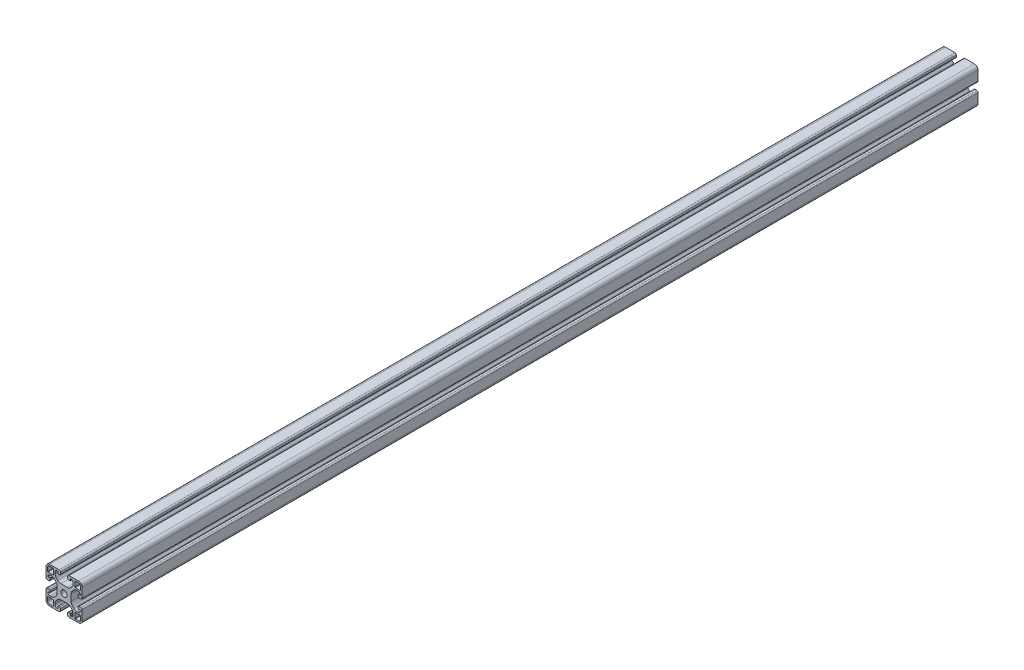
from build123d import *

# Parameters (mm, degrees)
ESQUISSE1_R        = 3.4
BOSS_EXTRU_1_DEPTH = 990


with BuildPart() as part:
    # Esquisse1 → Boss.-Extru.1 (new body)
    with BuildSketch(Plane(origin=(0, 0, -30), x_dir=(-1, 0, 0), z_dir=(0, 0, -1))):
        with BuildLine():
            Line((-4.5, 15), (-4.5, 13.5))
            ThreePointArc((-4.5, 13.5), (-4.353553391, 13.146446609), (-4, 13))
            Line((-4, 13), (-2.5, 13))
            ThreePointArc((-2.5, 13), (-2.146446609, 12.853553391), (-2, 12.5))
            ThreePointArc((-2, 12.5), (-2.732233047, 10.732233047), (-4.5, 10))
            Line((-4.5, 10), (-5.807611845, 10))
            ThreePointArc((-5.807611845, 10), (-7.721029006, 10.380602337), (-9.343145751, 11.464466094))
            Line((-9.343145751, 11.464466094), (-10.785533906, 12.906854249))
            ThreePointArc((-10.785533906, 12.906854249), (-11.869397663, 14.528970994), (-12.25, 16.442388155))
            Line((-12.25, 16.442388155), (-12.25, 23.557611845))
            ThreePointArc((-12.25, 23.557611845), (-11.869397663, 25.471029006), (-10.785533906, 27.093145751))
            Line((-10.785533906, 27.093145751), (-9.343145751, 28.535533906))
            ThreePointArc((-9.343145751, 28.535533906), (-7.721029006, 29.619397663), (-5.807611845, 30))
            Line((-5.807611845, 30), (-4.5, 30))
            ThreePointArc((-4.5, 30), (-2.732233047, 29.267766953), (-2, 27.5))
            ThreePointArc((-2, 27.5), (-2.146446609, 27.146446609), (-2.5, 27))
            Line((-2.5, 27), (-4, 27))
            ThreePointArc((-4, 27), (-4.353553391, 26.853553391), (-4.5, 26.5))
            Line((-4.5, 26.5), (-4.5, 25))
            ThreePointArc((-4.5, 25), (-4.207106781, 24.292893219), (-3.5, 24))
            Line((-3.5, 24), (-1.5, 24))
            ThreePointArc((-1.5, 24), (-0.439339828, 24.439339828), (0, 25.5))
            Line((0, 25.5), (0, 36))
            ThreePointArc((0, 36), (-1.171572875, 38.828427125), (-4, 40))
            Line((-4, 40), (-14.5, 40))
            ThreePointArc((-14.5, 40), (-15.560660172, 39.560660172), (-16, 38.5))
            Line((-16, 38.5), (-16, 36.5))
            ThreePointArc((-16, 36.5), (-15.707106781, 35.792893219), (-15, 35.5))
            Line((-15, 35.5), (-13.5, 35.5))
            ThreePointArc((-13.5, 35.5), (-13.146446609, 35.646446609), (-13, 36))
            Line((-13, 36), (-13, 37.5))
            ThreePointArc((-13, 37.5), (-12.853553391, 37.853553391), (-12.5, 38))
            ThreePointArc((-12.5, 38), (-10.732233047, 37.267766953), (-10, 35.5))
            Line((-10, 35.5), (-10, 34.192388155))
            ThreePointArc((-10, 34.192388155), (-10.380602337, 32.278970994), (-11.464466094, 30.656854249))
            Line((-11.464466094, 30.656854249), (-12.906854249, 29.214466094))
            ThreePointArc((-12.906854249, 29.214466094), (-14.528970994, 28.130602337), (-16.442388155, 27.75))
            Line((-16.442388155, 27.75), (-23.557611845, 27.75))
            ThreePointArc((-23.557611845, 27.75), (-25.471029006, 28.130602337), (-27.093145751, 29.214466094))
            Line((-27.093145751, 29.214466094), (-28.535533906, 30.656854249))
            ThreePointArc((-28.535533906, 30.656854249), (-29.619397663, 32.278970994), (-30, 34.192388155))
            Line((-30, 34.192388155), (-30, 35.5))
            ThreePointArc((-30, 35.5), (-29.267766953, 37.267766953), (-27.5, 38))
            ThreePointArc((-27.5, 38), (-27.146446609, 37.853553391), (-27, 37.5))
            Line((-27, 37.5), (-27, 36))
            ThreePointArc((-27, 36), (-26.853553391, 35.646446609), (-26.5, 35.5))
            Line((-26.5, 35.5), (-25, 35.5))
            ThreePointArc((-25, 35.5), (-24.292893219, 35.792893219), (-24, 36.5))
            Line((-24, 36.5), (-24, 38.5))
            ThreePointArc((-24, 38.5), (-24.439339828, 39.560660172), (-25.5, 40))
            Line((-25.5, 40), (-36, 40))
            ThreePointArc((-36, 40), (-38.828427125, 38.828427125), (-40, 36))
            Line((-40, 36), (-40, 25.5))
            ThreePointArc((-40, 25.5), (-39.560660172, 24.439339828), (-38.5, 24))
            Line((-38.5, 24), (-36.5, 24))
            ThreePointArc((-36.5, 24), (-35.792893219, 24.292893219), (-35.5, 25))
            Line((-35.5, 25), (-35.5, 26.5))
            ThreePointArc((-35.5, 26.5), (-35.646446609, 26.853553391), (-36, 27))
            Line((-36, 27), (-37.5, 27))
            ThreePointArc((-37.5, 27), (-37.853553391, 27.146446609), (-38, 27.5))
            ThreePointArc((-38, 27.5), (-37.267766953, 29.267766953), (-35.5, 30))
            Line((-35.5, 30), (-34.192388155, 30))
            ThreePointArc((-34.192388155, 30), (-32.278970994, 29.619397663), (-30.656854249, 28.535533906))
            Line((-30.656854249, 28.535533906), (-29.214466094, 27.093145751))
            ThreePointArc((-29.214466094, 27.093145751), (-28.130602337, 25.471029006), (-27.75, 23.557611845))
            Line((-27.75, 23.557611845), (-27.75, 16.442388155))
            ThreePointArc((-27.75, 16.442388155), (-28.130602337, 14.528970994), (-29.214466094, 12.906854249))
            Line((-29.214466094, 12.906854249), (-30.656854249, 11.464466094))
            ThreePointArc((-30.656854249, 11.464466094), (-32.278970994, 10.380602337), (-34.192388155, 10))
            Line((-34.192388155, 10), (-35.5, 10))
            ThreePointArc((-35.5, 10), (-37.267766953, 10.732233047), (-38, 12.5))
            ThreePointArc((-38, 12.5), (-37.853553391, 12.853553391), (-37.5, 13))
            Line((-37.5, 13), (-36, 13))
            ThreePointArc((-36, 13), (-35.646446609, 13.146446609), (-35.5, 13.5))
            Line((-35.5, 13.5), (-35.5, 15))
            ThreePointArc((-35.5, 15), (-35.792893219, 15.707106781), (-36.5, 16))
            Line((-36.5, 16), (-38.5, 16))
            ThreePointArc((-38.5, 16), (-39.560660172, 15.560660172), (-40, 14.5))
            Line((-40, 14.5), (-40, 4))
            ThreePointArc((-40, 4), (-38.828427125, 1.171572875), (-36, 0))
            Line((-36, 0), (-25.5, 0))
            ThreePointArc((-25.5, 0), (-24.439339828, 0.439339828), (-24, 1.5))
            Line((-24, 1.5), (-24, 3.5))
            ThreePointArc((-24, 3.5), (-24.292893219, 4.207106781), (-25, 4.5))
            Line((-25, 4.5), (-26.5, 4.5))
            ThreePointArc((-26.5, 4.5), (-26.853553391, 4.353553391), (-27, 4))
            Line((-27, 4), (-27, 2.5))
            ThreePointArc((-27, 2.5), (-27.146446609, 2.146446609), (-27.5, 2))
            ThreePointArc((-27.5, 2), (-29.267766953, 2.732233047), (-30, 4.5))
            Line((-30, 4.5), (-30, 5.807611845))
            ThreePointArc((-30, 5.807611845), (-29.619397663, 7.721029006), (-28.535533906, 9.343145751))
            Line((-28.535533906, 9.343145751), (-27.093145751, 10.785533906))
            ThreePointArc((-27.093145751, 10.785533906), (-25.471029006, 11.869397663), (-23.557611845, 12.25))
            Line((-23.557611845, 12.25), (-16.442388155, 12.25))
            ThreePointArc((-16.442388155, 12.25), (-14.528970994, 11.869397663), (-12.906854249, 10.785533906))
            Line((-12.906854249, 10.785533906), (-11.464466094, 9.343145751))
            ThreePointArc((-11.464466094, 9.343145751), (-10.380602337, 7.721029006), (-10, 5.807611845))
            Line((-10, 5.807611845), (-10, 4.5))
            ThreePointArc((-10, 4.5), (-10.732233047, 2.732233047), (-12.5, 2))
            ThreePointArc((-12.5, 2), (-12.853553391, 2.146446609), (-13, 2.5))
            Line((-13, 2.5), (-13, 4))
            ThreePointArc((-13, 4), (-13.146446609, 4.353553391), (-13.5, 4.5))
            Line((-13.5, 4.5), (-15, 4.5))
            ThreePointArc((-15, 4.5), (-15.707106781, 4.207106781), (-16, 3.5))
            Line((-16, 3.5), (-16, 1.5))
            ThreePointArc((-16, 1.5), (-15.560660172, 0.439339828), (-14.5, 0))
            Line((-14.5, 0), (-4, 0))
            ThreePointArc((-4, 0), (-1.171572875, 1.171572875), (0, 4))
            Line((0, 4), (0, 14.5))
            ThreePointArc((0, 14.5), (-0.439339828, 15.560660172), (-1.5, 16))
            Line((-1.5, 16), (-3.5, 16))
            ThreePointArc((-3.5, 16), (-4.207106781, 15.707106781), (-4.5, 15))
        make_face()
        with Locations(Location((-20, 20, 0), (0, 0, 180))):
            Circle(ESQUISSE1_R, mode=Mode.SUBTRACT)
        with BuildLine():
            Line((-4, 1.8), (-7.7, 1.8))
            ThreePointArc((-7.7, 1.8), (-8.053553391, 1.946446609), (-8.2, 2.3))
            Line((-8.2, 2.3), (-8.2, 7.7))
            ThreePointArc((-8.2, 7.7), (-8.053553391, 8.053553391), (-7.7, 8.2))
            Line((-7.7, 8.2), (-2.3, 8.2))
            ThreePointArc((-2.3, 8.2), (-1.946446609, 8.053553391), (-1.8, 7.7))
            Line((-1.8, 7.7), (-1.8, 4))
            ThreePointArc((-1.8, 4), (-2.444365081, 2.444365081), (-4, 1.8))
        make_face(mode=Mode.SUBTRACT)
        with BuildLine():
            Line((-38.2, 4), (-38.2, 7.7))
            ThreePointArc((-38.2, 7.7), (-38.053553391, 8.053553391), (-37.7, 8.2))
            Line((-37.7, 8.2), (-32.3, 8.2))
            ThreePointArc((-32.3, 8.2), (-31.946446609, 8.053553391), (-31.8, 7.7))
            Line((-31.8, 7.7), (-31.8, 2.3))
            ThreePointArc((-31.8, 2.3), (-31.946446609, 1.946446609), (-32.3, 1.8))
            Line((-32.3, 1.8), (-36, 1.8))
            ThreePointArc((-36, 1.8), (-37.555634919, 2.444365081), (-38.2, 4))
        make_face(mode=Mode.SUBTRACT)
        with BuildLine():
            Line((-36, 38.2), (-32.3, 38.2))
            ThreePointArc((-32.3, 38.2), (-31.946446609, 38.053553391), (-31.8, 37.7))
            Line((-31.8, 37.7), (-31.8, 32.3))
            ThreePointArc((-31.8, 32.3), (-31.946446609, 31.946446609), (-32.3, 31.8))
            Line((-32.3, 31.8), (-37.7, 31.8))
            ThreePointArc((-37.7, 31.8), (-38.053553391, 31.946446609), (-38.2, 32.3))
            Line((-38.2, 32.3), (-38.2, 36))
            ThreePointArc((-38.2, 36), (-37.555634919, 37.555634919), (-36, 38.2))
        make_face(mode=Mode.SUBTRACT)
        with BuildLine():
            Line((-1.8, 36), (-1.8, 32.3))
            ThreePointArc((-1.8, 32.3), (-1.946446609, 31.946446609), (-2.3, 31.8))
            Line((-2.3, 31.8), (-7.7, 31.8))
            ThreePointArc((-7.7, 31.8), (-8.053553391, 31.946446609), (-8.2, 32.3))
            Line((-8.2, 32.3), (-8.2, 37.7))
            ThreePointArc((-8.2, 37.7), (-8.053553391, 38.053553391), (-7.7, 38.2))
            Line((-7.7, 38.2), (-4, 38.2))
            ThreePointArc((-4, 38.2), (-2.444365081, 37.555634919), (-1.8, 36))
        make_face(mode=Mode.SUBTRACT)
    extrude(amount=-BOSS_EXTRU_1_DEPTH)


solid = part.part
